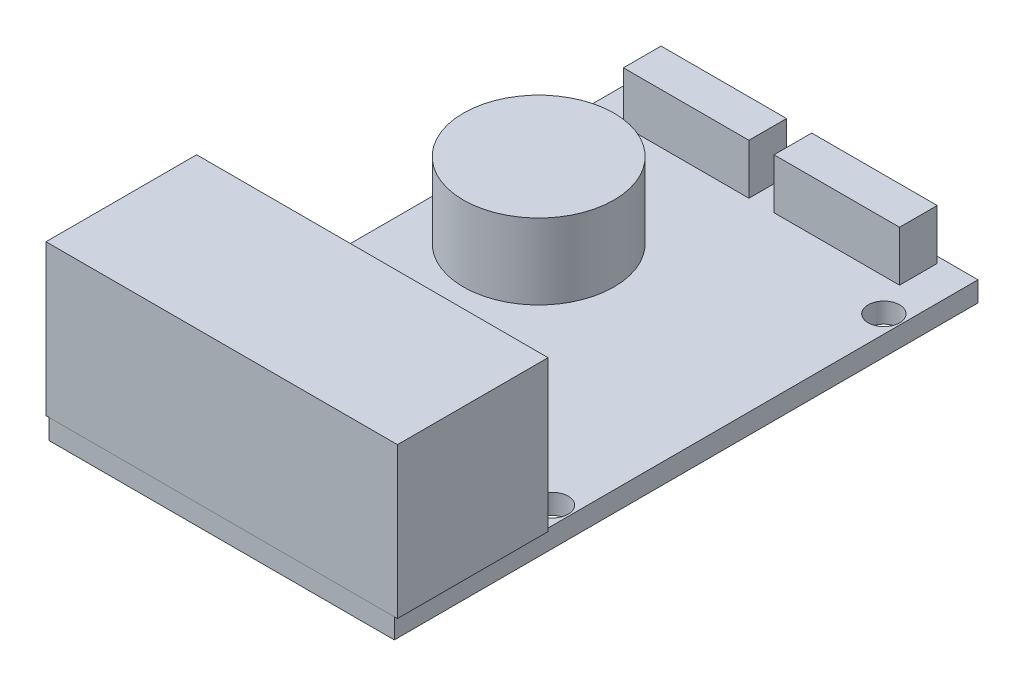
from build123d import *

# Parameters (mm, degrees)
SKETCH1_W            = 27.5
SKETCH1_H            = 46.5
PCB_DEPTH            = 1.6
SKETCH2_W            = 28
SKETCH2_H            = 12
SCANNER_DEPTH        = 12
SKETCH3_R            = 1.25
MOUNTING_HOLES_DEPTH = 30.674273369
SKETCH4_R            = 6
PIEZO_BUZZER_DEPTH   = 6
SKETCH5_W            = 10
SKETCH5_H            = 3
CONNECTORS_DEPTH     = 4


with BuildPart() as part:
    # Sketch1 → PCB (new body)
    with BuildSketch(Plane(origin=(0, 0, 0), x_dir=(1, 0, 0), z_dir=(0, 1, 0))):
        Rectangle(SKETCH1_W, SKETCH1_H)
    extrude(amount=PCB_DEPTH)

    # Sketch3 → Mounting Holes (cut, through all)
    with BuildSketch(Plane(origin=(0, 1.6, 0), x_dir=(1, 0, 0), z_dir=(0, 1, 0))):
        with Locations(Location((-12.35, 17.15, 0), (0, 0, 270))):
            Circle(SKETCH3_R)
        with Locations(Location((-12.35, -9.25, 0), (0, 0, 270))):
            Circle(SKETCH3_R)
        with Locations(Location((12.35, -9.25, 0), (0, 0, 90))):
            Circle(SKETCH3_R)
        with Locations(Location((12.35, 17.15, 0), (0, 0, 90))):
            Circle(SKETCH3_R)
    extrude(amount=-MOUNTING_HOLES_DEPTH, mode=Mode.SUBTRACT)

    # Sketch4 → Piezo Buzzer (add)
    with BuildSketch(Plane(origin=(0, 1.6, 0), x_dir=(1, 0, 0), z_dir=(0, 1, 0))):
        with Locations(Location((-6.25, 8.25, 0), (0, 0, 270))):
            Circle(SKETCH4_R)
    extrude(amount=PIEZO_BUZZER_DEPTH)

    # Sketch5 → Connectors (add)
    with BuildSketch(Plane(origin=(0, 1.6, 0), x_dir=(1, 0, 0), z_dir=(0, 1, 0))):
        with Locations((-6, 21.25)):
            Rectangle(SKETCH5_W, SKETCH5_H)
        with Locations((6, 21.25)):
            Rectangle(SKETCH5_W, SKETCH5_H)
    extrude(amount=CONNECTORS_DEPTH)


with BuildPart() as body_2:
    # Sketch2 → Scanner (new body)
    with BuildSketch(Plane.XY.offset(23.25)):
        with Locations((0, 7.6)):
            Rectangle(SKETCH2_W, SKETCH2_H)
    extrude(amount=-SCANNER_DEPTH)


solid = Compound([part.part, body_2.part])
